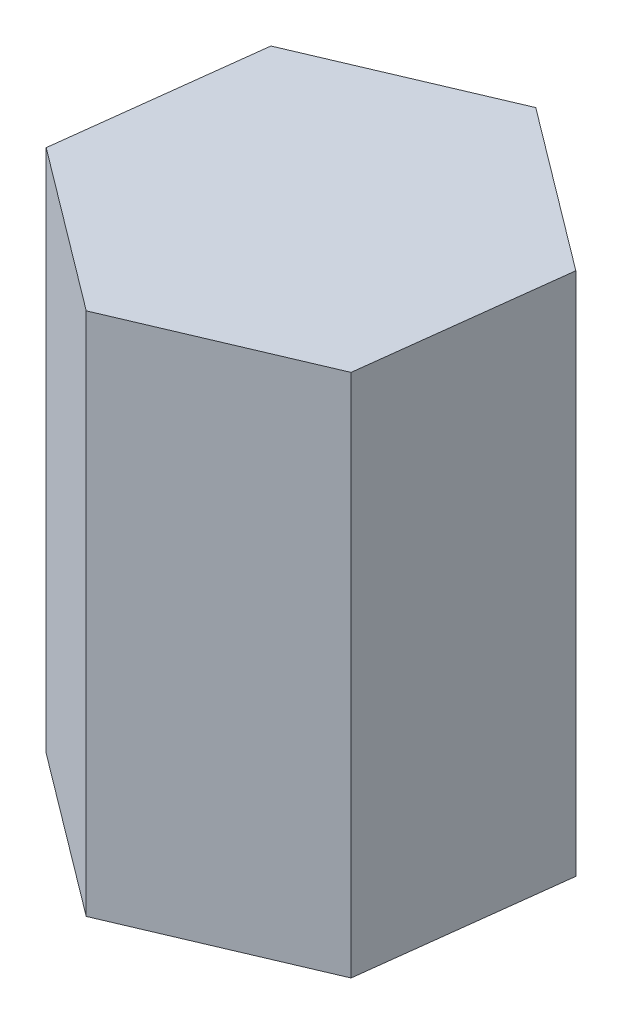
from build123d import *

# Parameters (mm, degrees)
BOSS_EXTRUDE1_DEPTH = 7.5


with BuildPart() as part:
    # Sketch1 → Boss-Extrude1 (new body)
    with BuildSketch(Plane(origin=(0, 0, 0), x_dir=(1, 0, 0), z_dir=(0, 1, 0))):
        Polygon((2.307490026, -1.734595951), (2.655949172, 1.131047006), (0.348459146, 2.865642957), (-2.307490026, 1.734595951), (-2.655949172, -1.131047006), (-0.348459146, -2.865642957), align=None)
    extrude(amount=BOSS_EXTRUDE1_DEPTH)


solid = part.part
